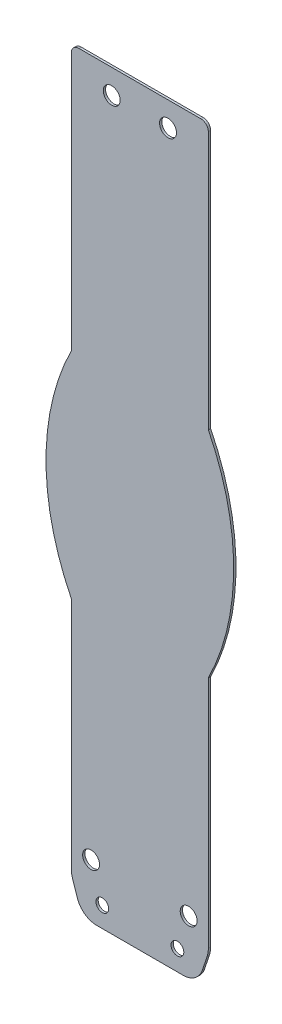
from build123d import *

# Parameters (mm, degrees)
BOSS_EXTRUDE1_DEPTH = 0.6096
SKETCH3_R           = 1.7
SKETCH3_R_2         = 2.25
CUT_EXTRUDE1_DEPTH  = 204.304258716
SKETCH4_W           = 18.25
SKETCH4_H           = 57.225
BOSS_EXTRUDE2_DEPTH = 0.6096


with BuildPart() as part:
    # Sketch2 → Boss-Extrude1 (new body)
    with BuildSketch(Plane.XY):
        with BuildLine():
            Line((34.883504, 3.686554855), (36.164103759, 7.513864099))
            ThreePointArc((36.164103759, 7.513864099), (36.415476383, 8.531517689), (36.5, 9.576344365))
            Line((36.5, 9.576344365), (36.5, 198))
            ThreePointArc((36.5, 198), (35.914213562, 199.414213562), (34.5, 200))
            Line((34.5, 200), (2, 200))
            ThreePointArc((2, 200), (0.585786438, 199.414213562), (0, 198))
            Line((0, 198), (0, 9.576344365))
            ThreePointArc((0, 9.576344365), (0.084523617, 8.531517689), (0.335896241, 7.513864099))
            Line((0.335896241, 7.513864099), (1.616496, 3.686554855))
            ThreePointArc((1.616496, 3.686554855), (3.582495544, 1.017500497), (6.737443738, 0))
            Line((6.737443738, 0), (29.762556262, 0))
            ThreePointArc((29.762556262, 0), (32.917504456, 1.017500497), (34.883504, 3.686554855))
        make_face()
    extrude(amount=BOSS_EXTRUDE1_DEPTH)

    # Sketch3 → Cut-Extrude1 (cut, through all)
    with BuildSketch(Plane.XY.offset(0.6096)):
        with Locations((8.25, 5.4)):
            Circle(SKETCH3_R)
        with Locations((5.25, 14.4)):
            Circle(SKETCH3_R_2)
        with Locations((10.75, 193.5)):
            Circle(SKETCH3_R_2)
        with Locations(Location((28.25, 5.4, 0), (0, 0, 180))):
            Circle(SKETCH3_R)
        with Locations(Location((31.25, 14.4, 0), (0, 0, 180))):
            Circle(SKETCH3_R_2)
        with Locations(Location((25.75, 193.5, 0), (0, 0, 180))):
            Circle(SKETCH3_R_2)
    extrude(amount=-CUT_EXTRUDE1_DEPTH, mode=Mode.SUBTRACT)

    # Sketch4 → Boss-Extrude2 (add)
    with BuildSketch(Plane.XY.offset(0.6096)):
        with Locations((9.125, 100.6125)):
            Rectangle(SKETCH4_W, SKETCH4_H)
        with BuildLine():
            ThreePointArc((0, 129.225), (-6.75, 100.6125), (0, 72))
            Line((0, 72), (0, 129.225))
        make_face()
        with Locations((27.375, 100.6125)):
            Rectangle(SKETCH4_W, SKETCH4_H)
        with BuildLine():
            Line((36.5, 129.225), (36.5, 72))
            ThreePointArc((36.5, 72), (43.25, 100.6125), (36.5, 129.225))
        make_face()
    extrude(amount=-BOSS_EXTRUDE2_DEPTH)


solid = part.part
